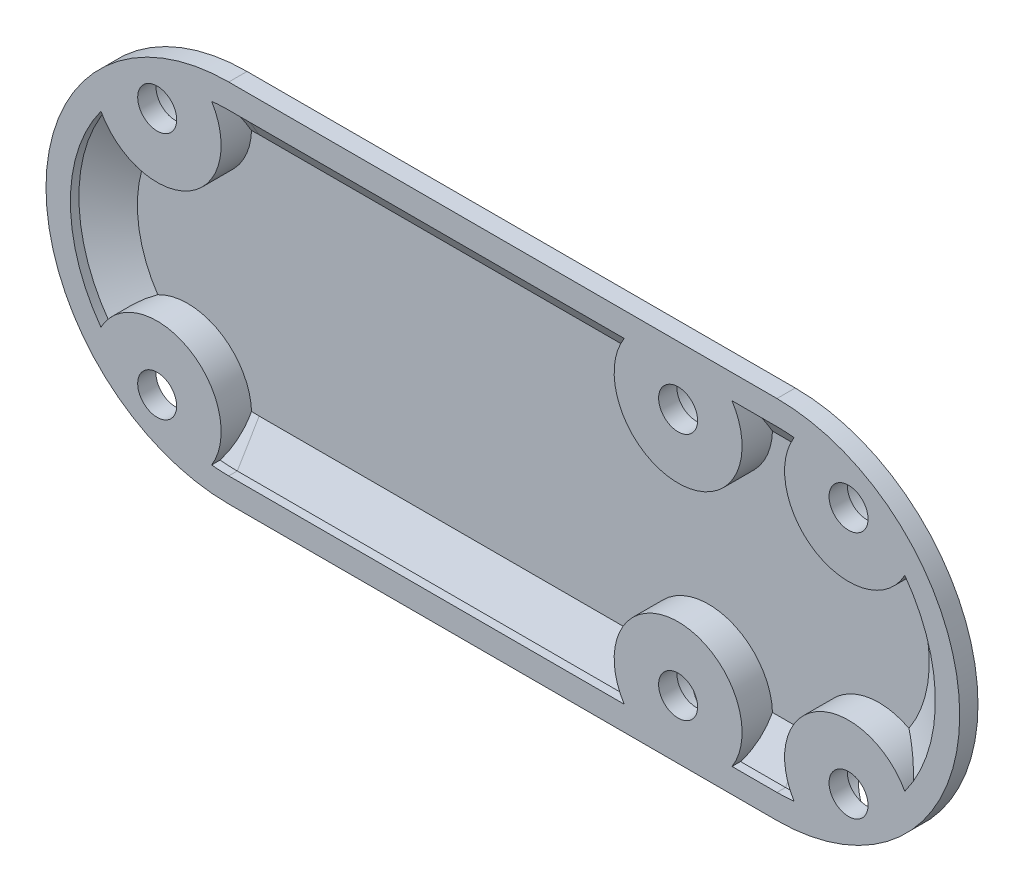
from build123d import *
from OCP.BRepFilletAPI import BRepFilletAPI_MakeChamfer

# Parameters (mm, degrees)
BOSS_EXTRUDE1_DEPTH = 4.5
CUT_EXTRUDE1_DEPTH  = 2.5
CHAMFER1_SIZE       = 1.8
CHAMFER1_SIZE2      = 3
CHAMFER2_SIZE       = 4.5
CHAMFER2_SIZE2      = 3
BOSS_EXTRUDE2_REACH = 56.197
SKETCH3_R           = 2.975
CUT_EXTRUDE2_DEPTH  = 3
CUT_EXTRUDE3_REACH  = 56.093
SKETCH5_R           = 1.6


with BuildPart() as part:
    # Sketch1 → Boss-Extrude1 (new body)
    with BuildSketch(Plane.XY):
        with BuildLine():
            Line((-36.885, 15), (8.115, 15))
            ThreePointArc((8.115, 15), (23.115, 0), (8.115, -15))
            Line((8.115, -15), (-36.885, -15))
            ThreePointArc((-36.885, -15), (-51.885, 0), (-36.885, 15))
        make_face()
    extrude(amount=BOSS_EXTRUDE1_DEPTH)

    # Sketch2 → Cut-Extrude1 (cut)
    with BuildSketch(Plane.XY.offset(4.5)):
        with BuildLine():
            Line((-36.885, 13), (8.115, 13))
            ThreePointArc((8.115, 13), (21.115, 0), (8.115, -13))
            Line((8.115, -13), (-36.885, -13))
            ThreePointArc((-36.885, -13), (-49.885, 0), (-36.885, 13))
        make_face()
    extrude(amount=-CUT_EXTRUDE1_DEPTH, mode=Mode.SUBTRACT)

    # Chamfer1: one chamfer whose edges measure the first distance from different faces: ONE call of the kernel's chamfer builder (chamfer() names one face for all edges)
    chamfer1_edges_1 = [part.edges().sort_by_distance(p)[0] for p in [
        (-49.885, 0, 2),
    ]]
    chamfer1_side_1 = [part.faces().sort_by_distance(p)[0] for p in [
        (-49.885, 0, 3.25),
    ]]
    chamfer1_edges_2 = [part.edges().sort_by_distance(p)[0] for p in [
        (-14.385, 13, 2),
    ]]
    chamfer1_side_2 = [part.faces().sort_by_distance(p)[0] for p in [
        (-14.385, 13, 3.25),
    ]]
    chamfer1_edges_3 = [part.edges().sort_by_distance(p)[0] for p in [
        (21.115, 0, 2),
    ]]
    chamfer1_side_3 = [part.faces().sort_by_distance(p)[0] for p in [
        (21.115, 0, 3.25),
    ]]
    chamfer1_edges_4 = [part.edges().sort_by_distance(p)[0] for p in [
        (-14.385, -13, 2),
    ]]
    chamfer1_side_4 = [part.faces().sort_by_distance(p)[0] for p in [
        (-14.385, -13, 3.25),
    ]]
    chamfer1 = BRepFilletAPI_MakeChamfer(part.part.solid().wrapped)
    for e in chamfer1_edges_1:
        chamfer1.Add(CHAMFER1_SIZE, CHAMFER1_SIZE2, e.wrapped, chamfer1_side_1[0].wrapped)  # the first distance lies on this face
    for e in chamfer1_edges_2:
        chamfer1.Add(CHAMFER1_SIZE, CHAMFER1_SIZE2, e.wrapped, chamfer1_side_2[0].wrapped)  # the first distance lies on this face
    for e in chamfer1_edges_3:
        chamfer1.Add(CHAMFER1_SIZE, CHAMFER1_SIZE2, e.wrapped, chamfer1_side_3[0].wrapped)  # the first distance lies on this face
    for e in chamfer1_edges_4:
        chamfer1.Add(CHAMFER1_SIZE, CHAMFER1_SIZE2, e.wrapped, chamfer1_side_4[0].wrapped)  # the first distance lies on this face
    add(Compound.cast(chamfer1.Shape()), mode=Mode.REPLACE)

    # Chamfer2
    chamfer2_edges = [part.edges().sort_by_distance(p)[0] for p in [
        (-14.385, 15, 0),
        (23.115, 0, 0),
        (-14.385, -15, 0),
        (-51.885, 0, 0),
    ]]
    chamfer2_side = [part.faces().sort_by_distance(p)[0] for p in [
        (-14.385, 0, 0),
    ]]
    chamfer(chamfer2_edges, length=CHAMFER2_SIZE, length2=CHAMFER2_SIZE2, reference=chamfer2_side[0])

    # Sketch4 → Boss-Extrude2 (add, up to next)
    with BuildSketch(Plane.XY.offset(4.5), mode=Mode.PRIVATE) as boss_extrude2_sk1:
        with BuildLine():
            Line((-4.425141241, 13), (4.425141241, 13))
            ThreePointArc((4.425141241, 13), (0, 4.925), (-4.425141241, 13))
        make_face()
    boss_extrude2_tool1 = extrude(boss_extrude2_sk1.sketch, amount=-BOSS_EXTRUDE2_REACH, mode=Mode.PRIVATE) - part.part
    # Sketch4 → Boss-Extrude2 (add, up to next)
    with BuildSketch(Plane.XY.offset(4.5), mode=Mode.PRIVATE) as boss_extrude2_sk2:
        with BuildLine():
            Line((-4.425141241, -13), (4.425141241, -13))
            ThreePointArc((4.425141241, -13), (0, -4.925), (-4.425141241, -13))
        make_face()
    boss_extrude2_tool2 = extrude(boss_extrude2_sk2.sketch, amount=-BOSS_EXTRUDE2_REACH, mode=Mode.PRIVATE) - part.part
    # Sketch4 → Boss-Extrude2 (add, up to next)
    with BuildSketch(Plane.XY.offset(4.5), mode=Mode.PRIVATE) as boss_extrude2_sk3:
        with BuildLine():
            ThreePointArc((-47.376988812, 7.675817271), (-40.134845505, 5.628455832), (-38.287336686, 12.924142208))
            ThreePointArc((-38.287336686, 12.924142208), (-43.38538256, 11.25810937), (-47.376988812, 7.675817271))
        make_face()
    boss_extrude2_tool3 = extrude(boss_extrude2_sk3.sketch, amount=-BOSS_EXTRUDE2_REACH, mode=Mode.PRIVATE) - part.part
    # Sketch4 → Boss-Extrude2 (add, up to next)
    with BuildSketch(Plane.XY.offset(4.5), mode=Mode.PRIVATE) as boss_extrude2_sk4:
        with BuildLine():
            ThreePointArc((9.517336686, 12.924142208), (11.364845505, 5.628455832), (18.606988812, 7.675817271))
            ThreePointArc((18.606988812, 7.675817271), (14.61538256, 11.25810937), (9.517336686, 12.924142208))
        make_face()
    boss_extrude2_tool4 = extrude(boss_extrude2_sk4.sketch, amount=-BOSS_EXTRUDE2_REACH, mode=Mode.PRIVATE) - part.part
    # Sketch4 → Boss-Extrude2 (add, up to next)
    with BuildSketch(Plane.XY.offset(4.5), mode=Mode.PRIVATE) as boss_extrude2_sk5:
        with BuildLine():
            ThreePointArc((18.606988812, -7.675817271), (11.364845505, -5.628455832), (9.517336686, -12.924142208))
            ThreePointArc((9.517336686, -12.924142208), (14.61538256, -11.25810937), (18.606988812, -7.675817271))
        make_face()
    boss_extrude2_tool5 = extrude(boss_extrude2_sk5.sketch, amount=-BOSS_EXTRUDE2_REACH, mode=Mode.PRIVATE) - part.part
    # Sketch4 → Boss-Extrude2 (add, up to next)
    with BuildSketch(Plane.XY.offset(4.5), mode=Mode.PRIVATE) as boss_extrude2_sk6:
        with BuildLine():
            ThreePointArc((-38.287336686, -12.924142208), (-40.134845505, -5.628455832), (-47.376988812, -7.675817271))
            ThreePointArc((-47.376988812, -7.675817271), (-43.38538256, -11.25810937), (-38.287336686, -12.924142208))
        make_face()
    boss_extrude2_tool6 = extrude(boss_extrude2_sk6.sketch, amount=-BOSS_EXTRUDE2_REACH, mode=Mode.PRIVATE) - part.part
    add(boss_extrude2_tool1.solids().sort_by_distance((0, 9.366558, 4.5))[0])
    add(boss_extrude2_tool2.solids().sort_by_distance((0, -9.366558, 4.5))[0])
    add(boss_extrude2_tool3.solids().sort_by_distance((-41.888013, 8.664793, 4.5))[0])
    add(boss_extrude2_tool4.solids().sort_by_distance((13.118013, 8.664793, 4.5))[0])
    add(boss_extrude2_tool5.solids().sort_by_distance((13.118013, -8.664793, 4.5))[0])
    add(boss_extrude2_tool6.solids().sort_by_distance((-41.888013, -8.664793, 4.5))[0])

    # Sketch3 → Cut-Extrude2 (cut)
    with BuildSketch(Plane(origin=(0, 0, 0), x_dir=(-1, 0, 0), z_dir=(0, 0, -1))):
        with Locations((-13.99, 10.175)):
            Circle(SKETCH3_R)
        with Locations((0, 10.175)):
            Circle(SKETCH3_R)
        with Locations((42.76, 10.175)):
            Circle(SKETCH3_R)
        with Locations((42.76, -10.175)):
            Circle(SKETCH3_R)
        with Locations((0, -10.175)):
            Circle(SKETCH3_R)
        with Locations((-13.99, -10.175)):
            Circle(SKETCH3_R)
    extrude(amount=-CUT_EXTRUDE2_DEPTH, mode=Mode.SUBTRACT)

    # Sketch5 → Cut-Extrude3 (cut, up to next)
    with BuildSketch(Plane(origin=(0, 0, 3), x_dir=(-1, 0, 0), z_dir=(0, 0, -1)), mode=Mode.PRIVATE) as cut_extrude3_sk1:
        with Locations((-13.99, 10.175)):
            Circle(SKETCH5_R)
    cut_extrude3_tool1 = extrude(cut_extrude3_sk1.sketch, amount=-CUT_EXTRUDE3_REACH, mode=Mode.PRIVATE) & part.part
    # Sketch5 → Cut-Extrude3 (cut, up to next)
    with BuildSketch(Plane(origin=(0, 0, 3), x_dir=(-1, 0, 0), z_dir=(0, 0, -1)), mode=Mode.PRIVATE) as cut_extrude3_sk2:
        with Locations((0, 10.175)):
            Circle(SKETCH5_R)
    cut_extrude3_tool2 = extrude(cut_extrude3_sk2.sketch, amount=-CUT_EXTRUDE3_REACH, mode=Mode.PRIVATE) & part.part
    # Sketch5 → Cut-Extrude3 (cut, up to next)
    with BuildSketch(Plane(origin=(0, 0, 3), x_dir=(-1, 0, 0), z_dir=(0, 0, -1)), mode=Mode.PRIVATE) as cut_extrude3_sk3:
        with Locations((42.76, 10.175)):
            Circle(SKETCH5_R)
    cut_extrude3_tool3 = extrude(cut_extrude3_sk3.sketch, amount=-CUT_EXTRUDE3_REACH, mode=Mode.PRIVATE) & part.part
    # Sketch5 → Cut-Extrude3 (cut, up to next)
    with BuildSketch(Plane(origin=(0, 0, 3), x_dir=(-1, 0, 0), z_dir=(0, 0, -1)), mode=Mode.PRIVATE) as cut_extrude3_sk4:
        with Locations((42.76, -10.175)):
            Circle(SKETCH5_R)
    cut_extrude3_tool4 = extrude(cut_extrude3_sk4.sketch, amount=-CUT_EXTRUDE3_REACH, mode=Mode.PRIVATE) & part.part
    # Sketch5 → Cut-Extrude3 (cut, up to next)
    with BuildSketch(Plane(origin=(0, 0, 3), x_dir=(-1, 0, 0), z_dir=(0, 0, -1)), mode=Mode.PRIVATE) as cut_extrude3_sk5:
        with Locations((0, -10.175)):
            Circle(SKETCH5_R)
    cut_extrude3_tool5 = extrude(cut_extrude3_sk5.sketch, amount=-CUT_EXTRUDE3_REACH, mode=Mode.PRIVATE) & part.part
    # Sketch5 → Cut-Extrude3 (cut, up to next)
    with BuildSketch(Plane(origin=(0, 0, 3), x_dir=(-1, 0, 0), z_dir=(0, 0, -1)), mode=Mode.PRIVATE) as cut_extrude3_sk6:
        with Locations((-13.99, -10.175)):
            Circle(SKETCH5_R)
    cut_extrude3_tool6 = extrude(cut_extrude3_sk6.sketch, amount=-CUT_EXTRUDE3_REACH, mode=Mode.PRIVATE) & part.part
    add(cut_extrude3_tool1.solids().sort_by_distance((13.99, 10.175, 3))[0], mode=Mode.SUBTRACT)
    add(cut_extrude3_tool2.solids().sort_by_distance((0, 10.175, 3))[0], mode=Mode.SUBTRACT)
    add(cut_extrude3_tool3.solids().sort_by_distance((-42.76, 10.175, 3))[0], mode=Mode.SUBTRACT)
    add(cut_extrude3_tool4.solids().sort_by_distance((-42.76, -10.175, 3))[0], mode=Mode.SUBTRACT)
    add(cut_extrude3_tool5.solids().sort_by_distance((0, -10.175, 3))[0], mode=Mode.SUBTRACT)
    add(cut_extrude3_tool6.solids().sort_by_distance((13.99, -10.175, 3))[0], mode=Mode.SUBTRACT)


solid = part.part
